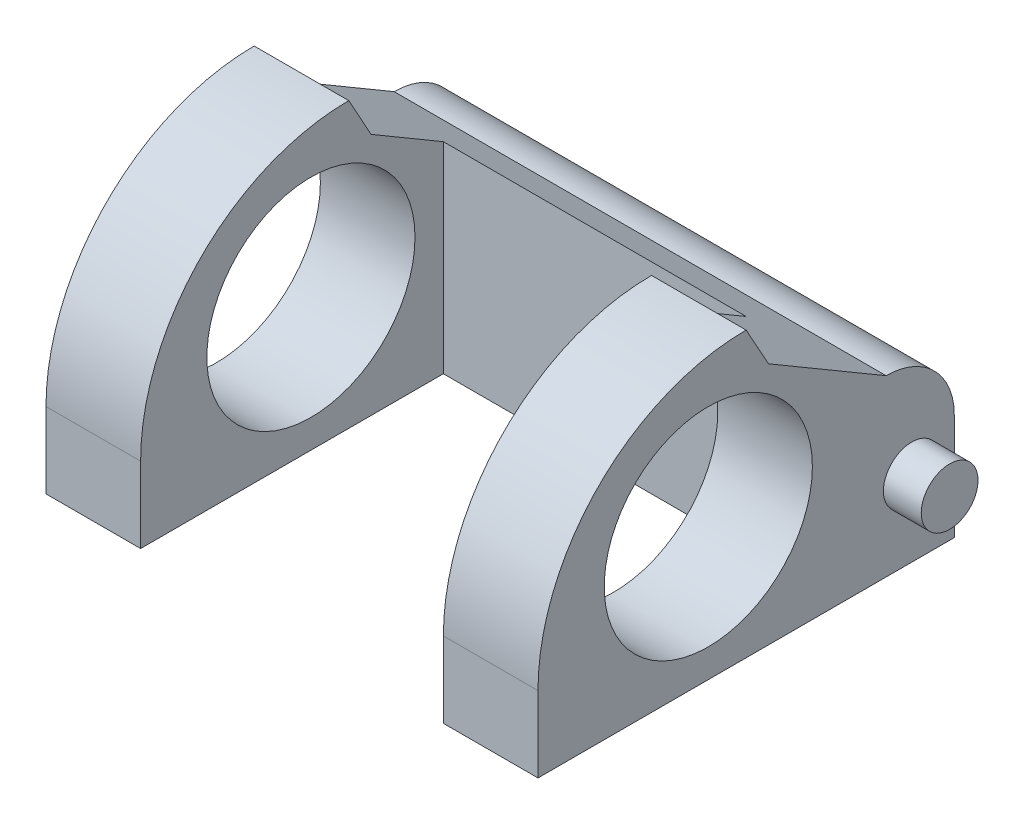
from build123d import *

# Parameters (mm, degrees)
SKETCH_3_W          = 13
SKETCH_3_H          = 11
EXTRUDE_1_DEPTH     = 10
SKETCH_5_R          = 2.75
CUT_EXTRUDE_3_DEPTH = 18.298843892
SKETCH_5_6_R        = 0.75
EXTRUDE_2_DEPTH     = 1
SKETCH_10_W         = 7
SKETCH_10_H         = 8
CUT_EXTRUDE_5_DEPTH = 12.947803145
SKETCH_11_W         = 0.5
SKETCH_11_H         = 8
CUT_EXTRUDE_6_DEPTH = 12.947803145


with BuildPart() as part:
    # 草图3 → 凸台-拉伸1 (new body)
    with BuildSketch(Plane(origin=(0, 0, 0), x_dir=(1, 0, 0), z_dir=(0, 1, 0))):
        Rectangle(SKETCH_3_W, SKETCH_3_H)
    extrude(amount=EXTRUDE_1_DEPTH)

    # 草图5 → 切除-拉伸3 (cut, through all)
    with BuildSketch(Plane(origin=(6.5, 0, 0), x_dir=(0, 0, -1), z_dir=(1, 0, 0))):
        with BuildLine():
            Line((-5.5, 10), (-5.5, 2))
            ThreePointArc((-5.5, 2), (-3.889087297, 5.889087297), (0, 7.5))
            Line((0, 7.5), (0.590375146, 6.432854109))
            Line((0.590375146, 6.432854109), (3.698964751, 4.606439417))
            ThreePointArc((3.698964751, 4.606439417), (4.972488989, 4.078928406), (5.5, 2.805404168))
            Line((5.5, 2.805404168), (5.5, 10))
            Line((5.5, 10), (-5.5, 10))
        make_face()
        with Locations((-1, 3.5)):
            Circle(SKETCH_5_R)
    extrude(amount=-CUT_EXTRUDE_3_DEPTH, mode=Mode.SUBTRACT)

    # 草图5<6> → 凸台-拉伸2 (add)
    with BuildSketch(Plane(origin=(6.5, 0, 0), x_dir=(0, 0, -1), z_dir=(1, 0, 0))):
        with Locations((4.376425526, 2)):
            Circle(SKETCH_5_6_R)
    extrude_2 = extrude(amount=EXTRUDE_2_DEPTH)

    # 草图10 → 切除-拉伸5 (cut, through all)
    with BuildSketch(Plane.XZ):
        with Locations((0, 1.5)):
            Rectangle(SKETCH_10_W, SKETCH_10_H)
    extrude(amount=-CUT_EXTRUDE_5_DEPTH, mode=Mode.SUBTRACT)

    # 镜向1: 凸台-拉伸2 across plane
    add(extrude_2.mirror(Plane(origin=(0, 0, 0), x_dir=(0, 0, 1), z_dir=(1, 0, 0))))

    # 草图11 → 切除-拉伸6 (cut, through all)
    with BuildSketch(Plane(origin=(0, 0, 0), x_dir=(-1, 0, 0), z_dir=(0, -1, 0))):
        with Locations((-3.75, -1.5)):
            Rectangle(SKETCH_11_W, SKETCH_11_H)
        with Locations((3.75, -1.5)):
            Rectangle(SKETCH_11_W, SKETCH_11_H)
    extrude(amount=-CUT_EXTRUDE_6_DEPTH, mode=Mode.SUBTRACT)


solid = part.part
